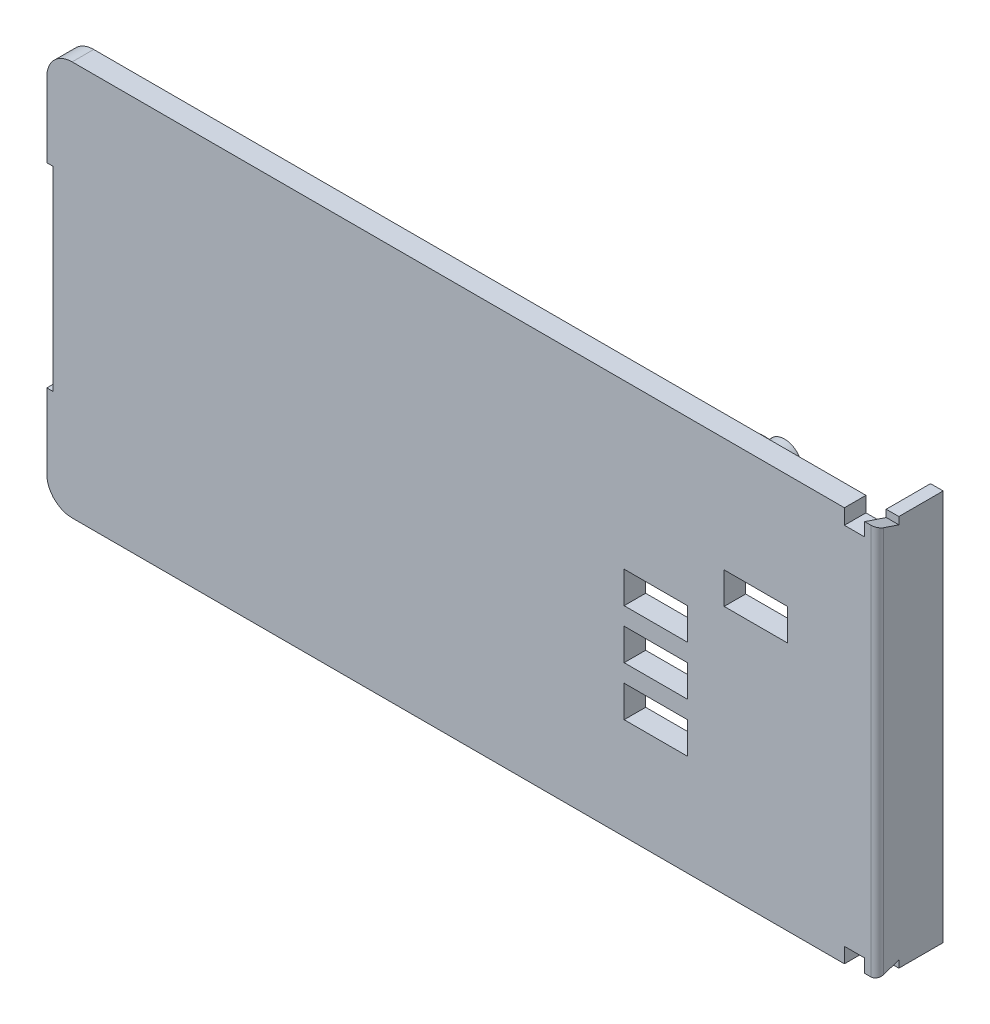
from build123d import *

# Parameters (mm, degrees)
BOSS_EXTRUDE1_DEPTH = 1.7
SKETCH2_W           = 1.2
SKETCH2_H           = 17.279106444
BOSS_EXTRUDE2_DEPTH = 3.5
CUT_EXTRUDE1_REACH  = 69.63
SKETCH4_W           = 0.999194929
SKETCH4_H           = 30.9
BOSS_EXTRUDE3_DEPTH = 3.5
FILLET1_R           = 2
FILLET2_R           = 0.5
SKETCH5_W           = 5
SKETCH5_H           = 2.5
CUT_EXTRUDE2_DEPTH  = 38.119536635
SKETCH6_W           = 10
SKETCH6_H           = 10
SKETCH6_W_2         = 8
SKETCH6_H_2         = 8
EXTRUDE_THIN1_DEPTH = 2.3
SKETCH8_R           = 1.4
BOSS_EXTRUDE4_DEPTH = 7
SKETCH8_2_R         = 2.4
SKETCH8_2_R_2       = 1.4
EXTRUDE_THIN2_DEPTH = 5.4


with BuildPart() as part:
    # Sketch1 → Boss-Extrude1 (new body)
    with BuildSketch(Plane.XY):
        Polygon((-32.1, 15.6), (30.9, 15.6), (30.9, 14.4), (32.500805071, 14.4), (32.500805071, 15.45), (33.5, 15.45), (33.5, -15.45), (32.500805071, -15.45), (32.500805071, -14.4), (30.9, -14.4), (30.9, -15.6), (-32.1, -15.6), (-32.1, -7.7), (-31.6, -7.7), (-31.6, 7.7), (-32.1, 7.7), align=None)
    extrude(amount=-BOSS_EXTRUDE1_DEPTH)

    # Sketch2 → Boss-Extrude2 (add)
    with BuildSketch(Plane(origin=(0, 0, -1.7), x_dir=(-1, 0, 0), z_dir=(0, 0, -1))):
        with Locations((31.5, -0.060446778)):
            Rectangle(SKETCH2_W, SKETCH2_H)
    extrude(amount=BOSS_EXTRUDE2_DEPTH)

    # Sketch3 → Cut-Extrude1 (cut, up to next)
    with BuildSketch(Plane(origin=(33.5, 0, 0), x_dir=(0, 0, -1), z_dir=(1, 0, 0)), mode=Mode.PRIVATE) as cut_extrude1_sk1:
        Polygon((1.7, 15.45), (0, 15.45), (1.7, 14.883333333), align=None)
    cut_extrude1_tool1 = extrude(cut_extrude1_sk1.sketch, amount=-CUT_EXTRUDE1_REACH, mode=Mode.PRIVATE) & part.part
    cut_extrude1 = cut_extrude1_tool1.solids().sort_by_distance((33.5, 15.261111, -1.133333))[0]
    add(cut_extrude1, mode=Mode.SUBTRACT)

    # Mirror1: Cut-Extrude1 across plane
    add(cut_extrude1.mirror(Plane.ZX), mode=Mode.SUBTRACT)

    # Sketch4 → Boss-Extrude3 (add)
    with BuildSketch(Plane(origin=(0, 0, -1.7), x_dir=(-1, 0, 0), z_dir=(0, 0, -1))):
        with Locations((-33.000402536, 0)):
            Rectangle(SKETCH4_W, SKETCH4_H)
    extrude(amount=BOSS_EXTRUDE3_DEPTH)

    # Fillet1
    fillet1_edges = [part.edges().sort_by_distance(p)[0] for p in [
        (-32.1, -15.6, -0.85),
        (-32.1, 15.6, -0.85),
    ]]
    fillet(fillet1_edges, radius=FILLET1_R)

    # Fillet2
    fillet2_edges = [part.edges().sort_by_distance(p)[0] for p in [
        (33.5, 0, 0),
    ]]
    fillet(fillet2_edges, radius=FILLET2_R)

    # Sketch5 → Cut-Extrude2 (cut, through all)
    with BuildSketch(Plane(origin=(0, 0, -1.7), x_dir=(-1, 0, 0), z_dir=(0, 0, -1))):
        with Locations((-16, -6.35)):
            Rectangle(SKETCH5_W, SKETCH5_H)
        with Locations((-16, -2.45)):
            Rectangle(SKETCH5_W, SKETCH5_H)
        with Locations((-16, 1.45)):
            Rectangle(SKETCH5_W, SKETCH5_H)
        with Locations((-23.9, 5.35)):
            Rectangle(SKETCH5_W, SKETCH5_H)
    extrude(amount=-CUT_EXTRUDE2_DEPTH, mode=Mode.SUBTRACT)

    # Sketch6 → Extrude-Thin1 (add)
    with BuildSketch(Plane(origin=(0, 0, -1.7), x_dir=(-1, 0, 0), z_dir=(0, 0, -1))):
        with Locations((12.508033049, -0.060446778)):
            Rectangle(SKETCH6_W, SKETCH6_H)
        with Locations((12.508033049, -0.060446778)):
            Rectangle(SKETCH6_W_2, SKETCH6_H_2, mode=Mode.SUBTRACT)
    extrude(amount=EXTRUDE_THIN1_DEPTH)

    # Sketch8 → Boss-Extrude4 (add)
    with BuildSketch(Plane(origin=(0, 0, -1.7), x_dir=(-1, 0, 0), z_dir=(0, 0, -1))):
        with Locations(Location((-22.549962349, -9.941736634, 0), (0, 0, 270))):
            Circle(SKETCH8_R)
        with Locations(Location((-17.469962349, 7.838263366, 0), (0, 0, 270))):
            Circle(SKETCH8_R)
    extrude(amount=BOSS_EXTRUDE4_DEPTH)

    # Sketch8<2> → Extrude-Thin2 (add)
    # profile 1 of 2: a face of its own
    with BuildSketch(Plane(origin=(0, 0, -1.7), x_dir=(-1, 0, 0), z_dir=(0, 0, -1))):
        with Locations((-22.549962349, -9.941736634)):
            Circle(SKETCH8_2_R)
        with Locations((-22.549962349, -9.941736634)):
            Circle(SKETCH8_2_R_2, mode=Mode.SUBTRACT)
    # profile 2 of 2: a face of its own
    with BuildSketch(Plane(origin=(0, 0, -1.7), x_dir=(-1, 0, 0), z_dir=(0, 0, -1))):
        with Locations((-17.469962349, 7.838263366)):
            Circle(SKETCH8_2_R)
        with Locations((-17.469962349, 7.838263366)):
            Circle(SKETCH8_2_R_2, mode=Mode.SUBTRACT)
    extrude(amount=EXTRUDE_THIN2_DEPTH)


solid = part.part
